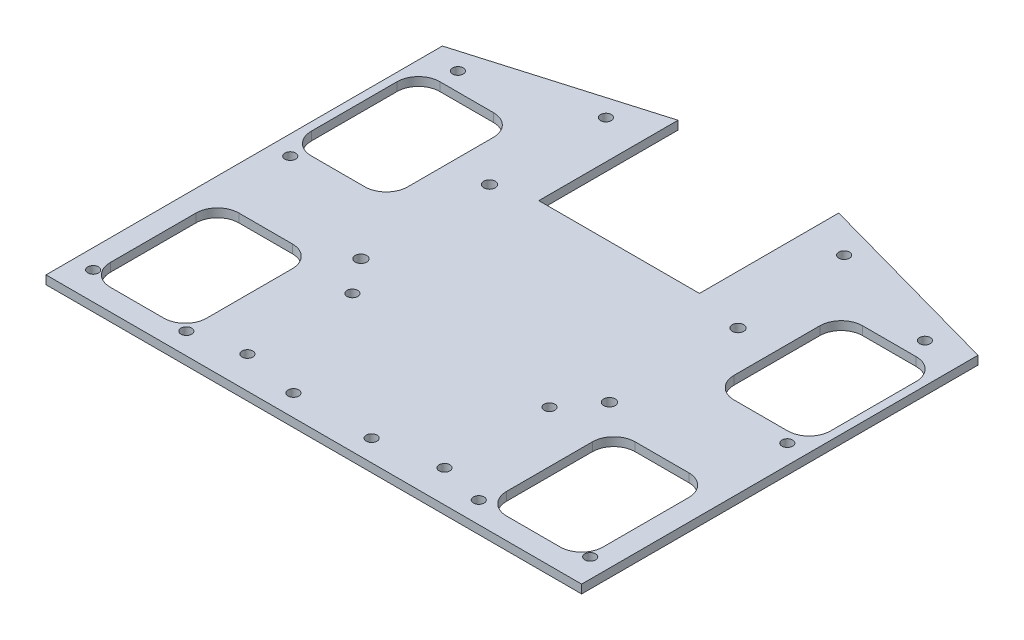
from build123d import *

# Parameters (mm, degrees)
SKETCH1_R           = 2.5
SKETCH1_R_2         = 2.7
BOSS_EXTRUDE1_DEPTH = 4
SKETCH4_W           = 280
SKETCH4_H           = 240
SKETCH4_W_2         = 250
SKETCH4_H_2         = 210
CUT_EXTRUDE2_DEPTH  = 10
SKETCH5_R           = 2.5
CUT_EXTRUDE3_DEPTH  = 10


with BuildPart() as part:
    # Sketch1 → Boss-Extrude1 (new body)
    with BuildSketch(Plane(origin=(0, 0, 0), x_dir=(1, 0, 0), z_dir=(0, 1, 0))):
        Polygon((-140, 120), (-140, -120), (140, -120), (140, 120), (35, 120), (35, 40), (-40, 40), (-40, 120), align=None)
        with Locations(Location((-116, -92, 0), (0, 0, 270))):
            Circle(SKETCH1_R, mode=Mode.SUBTRACT)
        with BuildLine():
            ThreePointArc((-70, -85), (-72.928932188, -92.071067812), (-80, -95))
            Line((-80, -95), (-105, -95))
            ThreePointArc((-105, -95), (-112.071067812, -92.071067812), (-115, -85))
            Line((-115, -85), (-115, -45))
            ThreePointArc((-115, -45), (-112.071067812, -37.928932188), (-105, -35))
            Line((-105, -35), (-80, -35))
            ThreePointArc((-80, -35), (-72.928932188, -37.928932188), (-70, -45))
            Line((-70, -45), (-70, -85))
        make_face(mode=Mode.SUBTRACT)
        with Locations(Location((-69.5, -95, 0), (0, 0, 270))):
            Circle(SKETCH1_R, mode=Mode.SUBTRACT)
        with Locations(Location((-19.5, -95, 0), (0, 0, 270))):
            Circle(SKETCH1_R, mode=Mode.SUBTRACT)
        with Locations(Location((-46, -90, 0), (0, 0, 270))):
            Circle(SKETCH1_R, mode=Mode.SUBTRACT)
        with Locations(Location((-116, 0, 0), (0, 0, 270))):
            Circle(SKETCH1_R, mode=Mode.SUBTRACT)
        with Locations(Location((-46, -41, 0), (0, 0, 270))):
            Circle(SKETCH1_R, mode=Mode.SUBTRACT)
        with Locations(Location((-58, -25, 0), (0, 0, 270))):
            Circle(SKETCH1_R_2, mode=Mode.SUBTRACT)
        with Locations(Location((17, -95, 0), (0, 0, 270))):
            Circle(SKETCH1_R, mode=Mode.SUBTRACT)
        with Locations(Location((67, -95, 0), (0, 0, 270))):
            Circle(SKETCH1_R, mode=Mode.SUBTRACT)
        with Locations(Location((46, -90, 0), (0, 0, 270))):
            Circle(SKETCH1_R, mode=Mode.SUBTRACT)
        with Locations(Location((116, -92, 0), (0, 0, 270))):
            Circle(SKETCH1_R, mode=Mode.SUBTRACT)
        with BuildLine():
            ThreePointArc((70, -45), (72.928932188, -37.928932188), (80, -35))
            Line((80, -35), (105, -35))
            ThreePointArc((105, -35), (112.071067812, -37.928932188), (115, -45))
            Line((115, -45), (115, -85))
            ThreePointArc((115, -85), (112.071067812, -92.071067812), (105, -95))
            Line((105, -95), (80, -95))
            ThreePointArc((80, -95), (72.928932188, -92.071067812), (70, -85))
            Line((70, -85), (70, -45))
        make_face(mode=Mode.SUBTRACT)
        with Locations(Location((46, -41, 0), (0, 0, 270))):
            Circle(SKETCH1_R, mode=Mode.SUBTRACT)
        with Locations(Location((58, -25, 0), (0, 0, 270))):
            Circle(SKETCH1_R_2, mode=Mode.SUBTRACT)
        with Locations(Location((116, 0, 0), (0, 0, 270))):
            Circle(SKETCH1_R, mode=Mode.SUBTRACT)
        with BuildLine():
            Line((-111.163447186, 65), (-86.163447186, 65))
            ThreePointArc((-86.163447186, 65), (-79.092379374, 62.071067812), (-76.163447186, 55))
            Line((-76.163447186, 55), (-76.163447186, 15))
            ThreePointArc((-76.163447186, 15), (-79.092379374, 7.928932188), (-86.163447186, 5))
            Line((-86.163447186, 5), (-111.163447186, 5))
            ThreePointArc((-111.163447186, 5), (-118.234514998, 7.928932188), (-121.163447186, 15))
            Line((-121.163447186, 15), (-121.163447186, 55))
            ThreePointArc((-121.163447186, 55), (-118.234514998, 62.071067812), (-111.163447186, 65))
        make_face(mode=Mode.SUBTRACT)
        with Locations(Location((-58, 35, 0), (0, 0, 270))):
            Circle(SKETCH1_R_2, mode=Mode.SUBTRACT)
        with Locations(Location((58, 35, 0), (0, 0, 270))):
            Circle(SKETCH1_R_2, mode=Mode.SUBTRACT)
        with BuildLine():
            Line((76.163447186, 15), (76.163447186, 55))
            ThreePointArc((76.163447186, 55), (79.092379374, 62.071067812), (86.163447186, 65))
            Line((86.163447186, 65), (111.163447186, 65))
            ThreePointArc((111.163447186, 65), (118.234514998, 62.071067812), (121.163447186, 55))
            Line((121.163447186, 55), (121.163447186, 15))
            ThreePointArc((121.163447186, 15), (118.234514998, 7.928932188), (111.163447186, 5))
            Line((111.163447186, 5), (86.163447186, 5))
            ThreePointArc((86.163447186, 5), (79.092379374, 7.928932188), (76.163447186, 15))
        make_face(mode=Mode.SUBTRACT)
    extrude(amount=BOSS_EXTRUDE1_DEPTH)

    # Sketch4 → Cut-Extrude2 (cut)
    with BuildSketch(Plane(origin=(0, 4, 0), x_dir=(1, 0, 0), z_dir=(0, 1, 0))):
        Rectangle(SKETCH4_W, SKETCH4_H)
        Rectangle(SKETCH4_W_2, SKETCH4_H_2, mode=Mode.SUBTRACT)
    extrude(amount=-CUT_EXTRUDE2_DEPTH, mode=Mode.SUBTRACT)

    # Sketch5 → Cut-Extrude3 (cut)
    with BuildSketch(Plane(origin=(0, 4, 0), x_dir=(1, 0, 0), z_dir=(0, 1, 0))):
        with Locations(Location((-111.290658089, 73.532159386, 0), (0, 0, 270))):
            Circle(SKETCH5_R)
        with Locations(Location((-57.899945704, 89.235310087, 0), (0, 0, 270))):
            Circle(SKETCH5_R)
        with Locations(Location((53.295143169, 89.235310087, 0), (0, 0, 270))):
            Circle(SKETCH5_R)
        with Locations(Location((106.685855553, 73.532159386, 0), (0, 0, 270))):
            Circle(SKETCH5_R)
        Polygon((-40, 105), (-125, 80), (-125, 105), align=None)
        Polygon((35, 105), (125, 105), (125, 80), align=None)
    extrude(amount=-CUT_EXTRUDE3_DEPTH, mode=Mode.SUBTRACT)


solid = part.part
